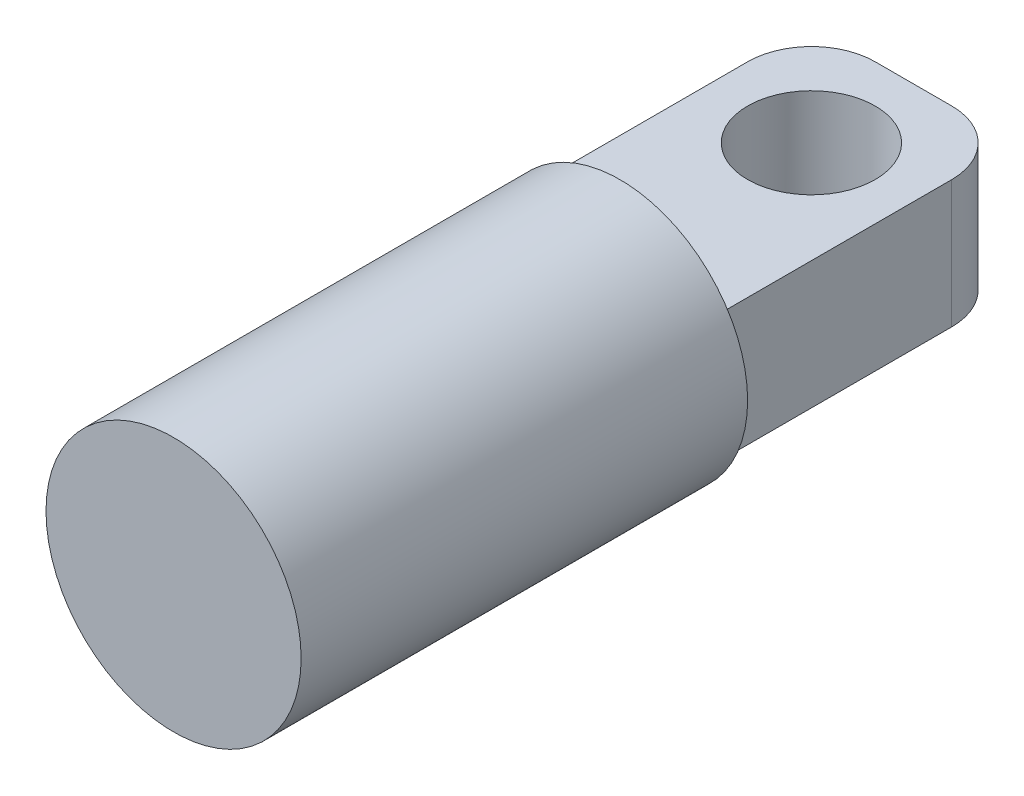
from build123d import *

# Parameters (mm, degrees)
SKETCH1_R                = 25.4
BOSS_EXTRUDE1_DEPTH      = 88.9
BOSS_EXTRUDE2_DEPTH      = 20.32
BOSS_EXTRUDE2_DEPTH_BACK = 20.32
SKETCH2_W                = 58.42
SKETCH2_H                = 25.4
FILLET1_R                = 12.7
SKETCH3_R                = 12.7
CUT_EXTRUDE3_DEPTH       = 155.272331933


with BuildPart() as part:
    # Sketch1 → Boss-Extrude1 (new body)
    with BuildSketch(Plane.XY):
        Circle(SKETCH1_R)
    extrude(amount=-BOSS_EXTRUDE1_DEPTH)

    # Sketch2 → Boss-Extrude2 (add, two sides: drawn at the far end of the back side and taken through both)
    with BuildSketch(Plane(origin=(0, 0, 0), x_dir=(0, 0, -1), z_dir=(1, 0, 0)).offset(-BOSS_EXTRUDE2_DEPTH_BACK)):
        with Locations((118.11, 0)):
            Rectangle(SKETCH2_W, SKETCH2_H)
    extrude(amount=BOSS_EXTRUDE2_DEPTH + BOSS_EXTRUDE2_DEPTH_BACK)

    # Fillet1
    fillet1_edges = [part.edges().sort_by_distance(p)[0] for p in [
        (20.32, 0, -147.32),
        (-20.32, 0, -147.32),
    ]]
    fillet(fillet1_edges, radius=FILLET1_R)

    # Sketch3 → Cut-Extrude3 (cut, through all)
    with BuildSketch(Plane(origin=(0, 12.7, 0), x_dir=(1, 0, 0), z_dir=(0, 1, 0))):
        with Locations((0, 127)):
            Circle(SKETCH3_R)
    extrude(amount=-CUT_EXTRUDE3_DEPTH, mode=Mode.SUBTRACT)


solid = part.part
